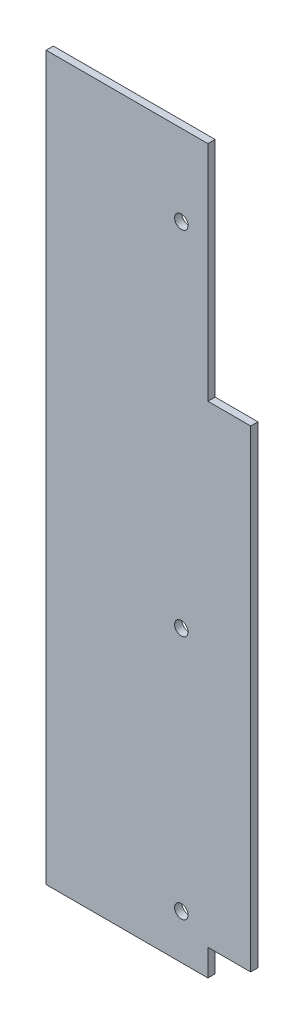
from build123d import *

# Parameters (mm, degrees)
SKETCH1_W                          = 35.56
SKETCH1_H                          = 146.05
EXTRUDE1_DEPTH                     = 1.5875
SKETCH3_W                          = 1.5875
SKETCH3_H                          = 103.886
EXTRUDE2_DEPTH                     = 9.398
F_32_0_116000_DIAMETER_HOLE1_D     = 2.9464
F_32_0_116000_DIAMETER_HOLE1_DEPTH = 25.4
F_32_0_116000_DIAMETER_HOLE1_TIP   = 0.885187864
SKETCH7_W                          = 35.56
SKETCH7_H                          = 1.5875
EXTRUDE3_DEPTH                     = 12.7


with BuildPart() as part:
    # Sketch1 → Extrude1 (new body)
    with BuildSketch(Plane.XY):
        with Locations((17.78, 73.025)):
            Rectangle(SKETCH1_W, SKETCH1_H)
    extrude(amount=EXTRUDE1_DEPTH)

    # Sketch3 → Extrude2 (add)
    with BuildSketch(Plane(origin=(35.56, 0, 0), x_dir=(0, 0, -1), z_dir=(1, 0, 0))):
        with Locations((-0.79375, 57.785)):
            Rectangle(SKETCH3_W, SKETCH3_H)
    extrude(amount=EXTRUDE2_DEPTH)

    # #32 (0.116000) Diameter Hole1
    with Locations(Plane(origin=(29.718, 9.779, 1.5875), x_dir=(1, 0, 0), z_dir=(0, 0, 1))):
        with Locations((0, 0), (0, 53.848), (0, 131.191)):
            Hole(F_32_0_116000_DIAMETER_HOLE1_D / 2, depth=F_32_0_116000_DIAMETER_HOLE1_DEPTH)
            with Locations((0, 0, -(F_32_0_116000_DIAMETER_HOLE1_DEPTH + F_32_0_116000_DIAMETER_HOLE1_TIP / 2))):  # 118° drill point
                Cone(0, F_32_0_116000_DIAMETER_HOLE1_D / 2, F_32_0_116000_DIAMETER_HOLE1_TIP, mode=Mode.SUBTRACT)

    # Sketch7 → Extrude3 (add)
    with BuildSketch(Plane(origin=(0, 146.05, 0), x_dir=(-1, 0, 0), z_dir=(0, 1, 0))):
        with Locations((-17.78, 0.79375)):
            Rectangle(SKETCH7_W, SKETCH7_H)
    extrude(amount=EXTRUDE3_DEPTH)


solid = part.part
